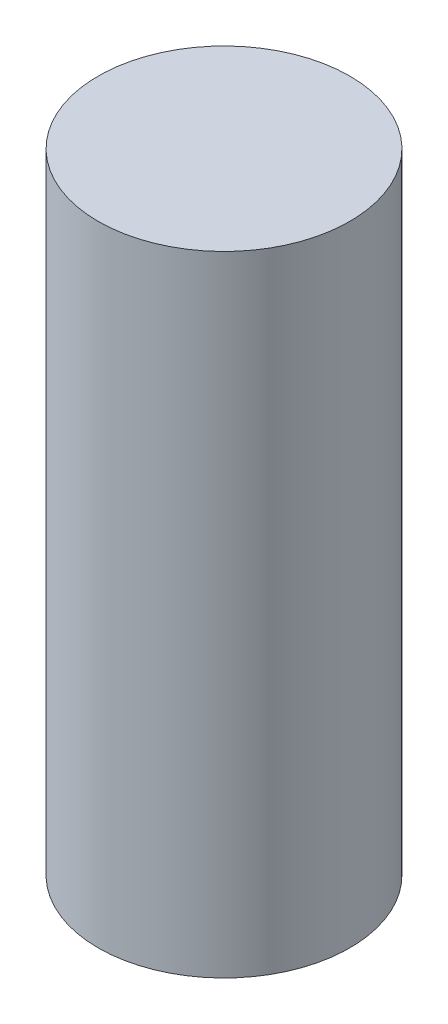
from build123d import *

# Parameters (mm, degrees)
SKETCH1_R           = 2.5
BOSS_EXTRUDE1_DEPTH = 12.5


with BuildPart() as part:
    # Sketch1 → Boss-Extrude1 (new body)
    with BuildSketch(Plane(origin=(0, 0, 0), x_dir=(1, 0, 0), z_dir=(0, 1, 0))):
        with Locations(Location((0, 0, 0), (0, 0, 270))):
            Circle(SKETCH1_R)
    extrude(amount=BOSS_EXTRUDE1_DEPTH)


solid = part.part
